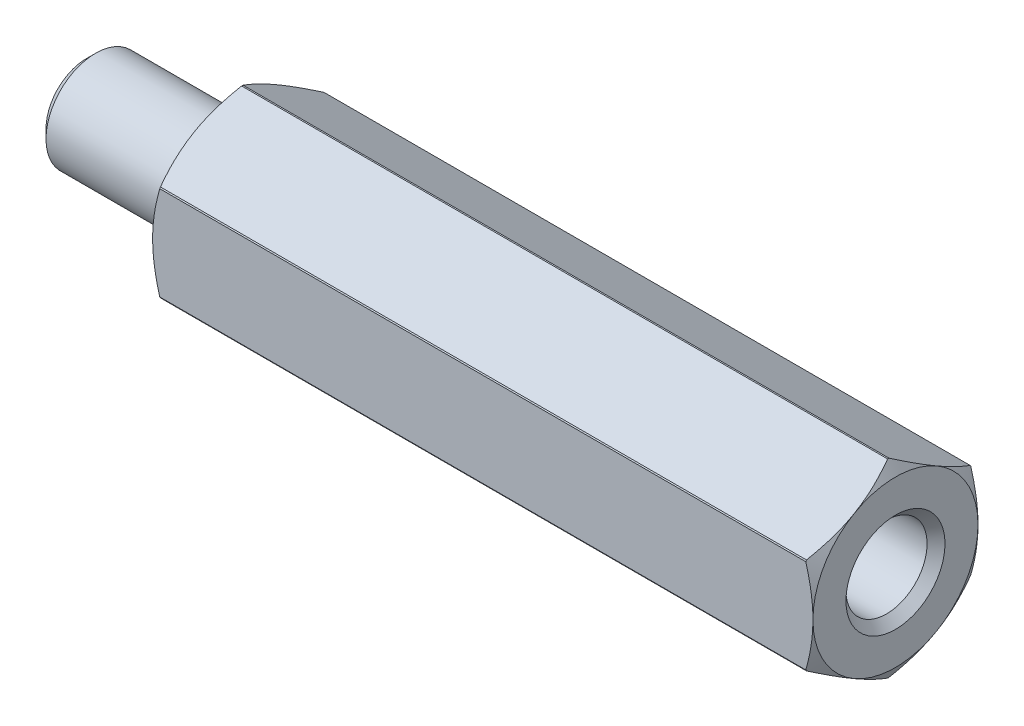
from build123d import *

# Parameters (mm, degrees)
SKETCH2_W          = 20
SKETCH2_H          = 20
CUT_EXTRUDE1_DEPTH = 40


with BuildPart() as part:
    # Sketch1 → Revolve1 (revolve)
    with BuildSketch(Plane.XY, mode=Mode.PRIVATE) as revolve1_sk:
        Polygon((0, 0), (0, 5), (0.433012702, 5.75), (39.566987298, 5.75), (40, 5), (40, 0), align=None)
    revolve(revolve1_sk.sketch.rotate(Axis((40, 0, 0), (-1, 0, 0)), 270), axis=Axis((40, 0, 0), (-1, 0, 0)))

    # Sketch2 → Cut-Extrude1 (cut)
    with BuildSketch(Plane(origin=(0, 0, 0), x_dir=(0, 0, -1), z_dir=(1, 0, 0))):
        Rectangle(SKETCH2_W, SKETCH2_H)
        Polygon((-5, 2.886751346), (-5, -2.886751346), (0, -5.773502692), (5, -2.886751346), (5, 2.886751346), (0, 5.773502692), align=None, mode=Mode.SUBTRACT)
    extrude(amount=CUT_EXTRUDE1_DEPTH, mode=Mode.SUBTRACT)

    # Sketch3 → Cut-Revolve1 (revolve, cut)
    with BuildSketch(Plane.XY, mode=Mode.PRIVATE) as cut_revolve1_sk:
        Polygon((25.6, 0), (27.019415637, 2.4585), (39.4585, 2.4585), (40, 3), (40, 0), align=None)
    revolve(cut_revolve1_sk.sketch.rotate(Axis((40, 0, 0), (-1, 0, 0)), 270), axis=Axis((40, 0, 0), (-1, 0, 0)), mode=Mode.SUBTRACT)

    # Sketch4 → Revolve2 (revolve)
    with BuildSketch(Plane.XY, mode=Mode.PRIVATE) as revolve2_sk:
        Polygon((-9, 0), (-9, 2.4585), (-8.4585, 3), (-0.9, 3), (-0.9, 2.4585), (0, 2.4585), (0, 0), align=None)
    revolve(revolve2_sk.sketch.rotate(Axis((0, 0, 0), (-1, 0, 0)), 270), axis=Axis((0, 0, 0), (-1, 0, 0)))


solid = part.part
